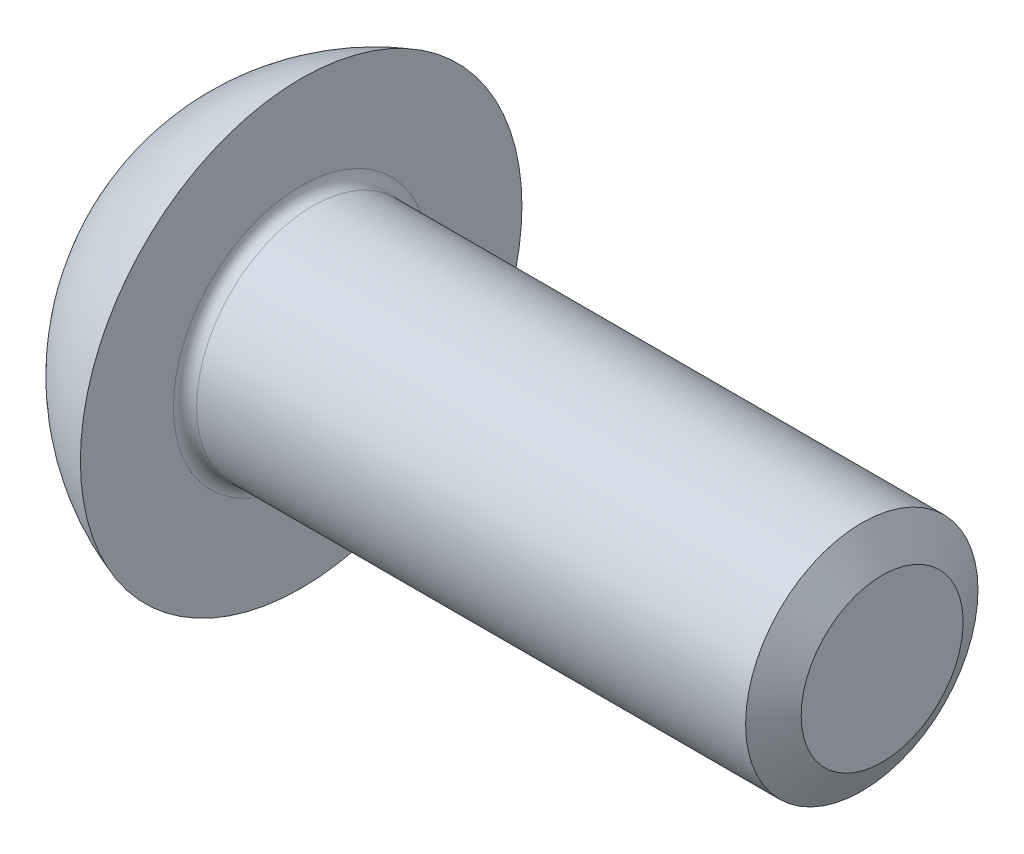
from build123d import *

# Parameters (mm, degrees)
CUT_EXTRUDE_1_DEPTH = 2.2


with BuildPart() as part:
    # 草图1 → 旋转1 (revolve)
    with BuildSketch(Plane.XY):
        with BuildLine():
            Line((0, 2), (-9.8, 2))
            ThreePointArc((-9.8, 2), (-9.941421356, 2.058578644), (-10, 2.2))
            Line((-10, 2.2), (-10, 3.8))
            ThreePointArc((-10, 3.8), (-11.264955669, 3.101612484), (-12.2, 2))
            Line((-12.2, 2), (-12.2, 0))
            Line((-12.2, 0), (0, 0))
            Line((0, 0), (0, 2))
        make_face()
    revolve(axis=Axis((-12.2, 0, 0), (1, 0, 0)))

    # 草图2 → 切除-拉伸1 (cut)
    with BuildSketch(Plane.ZY.offset(12.2)):
        Polygon((0, 1.443375673), (-1.25, 0.721687836), (-1.25, -0.721687836), (0, -1.443375673), (1.25, -0.721687836), (1.25, 0.721687836), align=None)
    extrude(amount=-CUT_EXTRUDE_1_DEPTH, mode=Mode.SUBTRACT)

    # 草图6 → 旋转2 (revolve)
    with BuildSketch(Plane.XY):
        Polygon((-10.9, 1.443375673), (-10, 0), (-9.63, 0), (-9.63, 1.443375673), align=None)
    revolve(axis=Axis((-12.2, 0, 0), (1, 0, 0)))

    # 草图7 → 切除-旋转5 (revolve, cut)
    with BuildSketch(Plane.XY):
        Polygon((-12.2, 1.443375673), (-11.83, 0), (-12.2, 0), align=None)
    revolve(axis=Axis((-12.2, 0, 0), (1, 0, 0)), mode=Mode.SUBTRACT)

    # 草图4 → 切除-旋转1 (revolve, cut)
    with BuildSketch(Plane.XY):
        Polygon((-0.35, 2), (0, 1.393782217), (0.35, 2), align=None)
    revolve(axis=Axis((-0.35, 0, 0), (1, 0, 0)), mode=Mode.SUBTRACT)


solid = part.part
